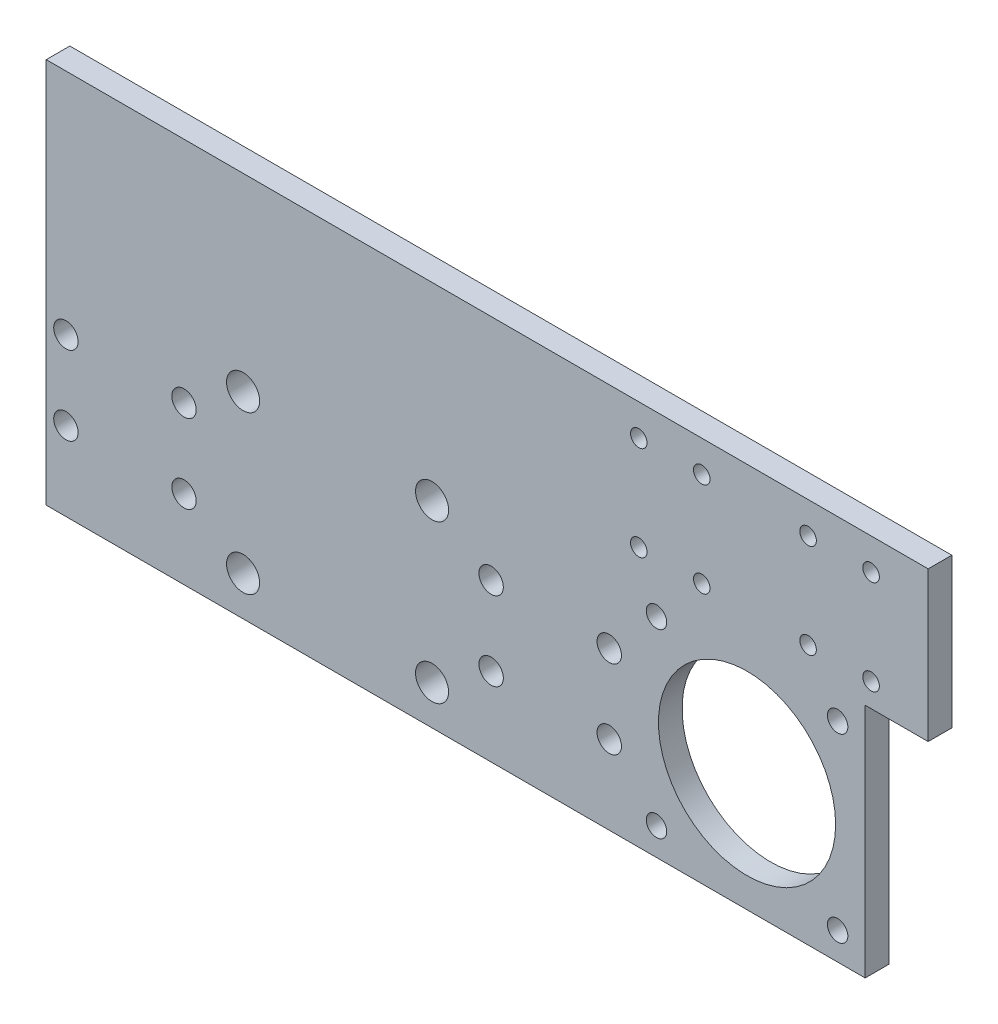
from build123d import *

# Parameters (mm, degrees)
SKETCH_1_W          = 74
SKETCH_1_H          = 30
EXTRUDE_1_DEPTH     = 3
SKETCH_2_R          = 1.55
SKETCH_2_R_2        = 2.1
CUT_EXTRUDE_1_DEPTH = 3
SKETCH_3_W          = 30
SKETCH_3_H          = 30
SKETCH_3_R          = 11.25
SKETCH_3_R_2        = 1.3
EXTRUDE_2_DEPTH     = 3
SKETCH_4_W          = 74
SKETCH_4_H          = 19
EXTRUDE_3_DEPTH     = 3
SKETCH_5_R          = 1.05
CUT_EXTRUDE_2_DEPTH = 10
SKETCH_6_R          = 1.05
CUT_EXTRUDE_4_DEPTH = 10
SKETCH_7_W          = 30
SKETCH_7_H          = 3
EXTRUDE_4_DEPTH     = 19
SKETCH_10_W         = 8
SKETCH_10_H         = 19
EXTRUDE_6_DEPTH     = 3
SKETCH_11_R         = 1.05
CUT_EXTRUDE_5_DEPTH = 10
SKETCH_12_W         = 72.681959433
SKETCH_12_H         = 19
EXTRUDE_7_DEPTH     = 3
SKETCH_13_R         = 1.05
CUT_EXTRUDE_7_DEPTH = 3


with BuildPart() as part:
    # 草图1 → 凸台-拉伸1 (new body)
    with BuildSketch(Plane.XY):
        Rectangle(SKETCH_1_W, SKETCH_1_H)
    extrude(amount=EXTRUDE_1_DEPTH)

    # 草图2 → 切除-拉伸1 (cut)
    with BuildSketch(Plane(origin=(0, 0, 0), x_dir=(-1, 0, 0), z_dir=(0, 0, -1))):
        with Locations((-34.5, 5)):
            Circle(SKETCH_2_R)
        with Locations((-34.5, -5)):
            Circle(SKETCH_2_R)
        with Locations((-19.5, 5)):
            Circle(SKETCH_2_R)
        with Locations((-19.5, -5)):
            Circle(SKETCH_2_R)
        with Locations((-12, 10)):
            Circle(SKETCH_2_R_2)
        with Locations((12, 10)):
            Circle(SKETCH_2_R_2)
        with Locations((-12, -10)):
            Circle(SKETCH_2_R_2)
        with Locations((12, -10)):
            Circle(SKETCH_2_R_2)
        with Locations((34.5, 5)):
            Circle(SKETCH_2_R)
        with Locations((34.5, -5)):
            Circle(SKETCH_2_R)
        with Locations((19.5, 5)):
            Circle(SKETCH_2_R)
        with Locations((19.5, -5)):
            Circle(SKETCH_2_R)
    extrude(amount=-CUT_EXTRUDE_1_DEPTH, mode=Mode.SUBTRACT)

    # 草图3 → 凸台-拉伸2 (add)
    with BuildSketch(Plane.XY.offset(3)):
        with Locations((52, 0)):
            Rectangle(SKETCH_3_W, SKETCH_3_H)
        with Locations((52, 0)):
            Circle(SKETCH_3_R, mode=Mode.SUBTRACT)
        with Locations((40.5, 11.5)):
            Circle(SKETCH_3_R_2, mode=Mode.SUBTRACT)
        with Locations((63.5, 11.5)):
            Circle(SKETCH_3_R_2, mode=Mode.SUBTRACT)
        with Locations((40.5, -11.5)):
            Circle(SKETCH_3_R_2, mode=Mode.SUBTRACT)
        with Locations((63.5, -11.5)):
            Circle(SKETCH_3_R_2, mode=Mode.SUBTRACT)
    extrude(amount=-EXTRUDE_2_DEPTH)

    # 草图4 → 凸台-拉伸3 (add, through all)
    with BuildSketch(Plane.XY.offset(3)):
        with Locations((0, 24.5)):
            Rectangle(SKETCH_4_W, SKETCH_4_H)
    extrude(amount=-EXTRUDE_3_DEPTH)

    # 草图5 → 切除-拉伸2 (cut)
    with BuildSketch(Plane.XY.offset(3)):
        with Locations((-21.5, 31.5)):
            Circle(SKETCH_5_R)
        with Locations((-21.5, 16.5)):
            Circle(SKETCH_5_R)
        with Locations((-11.5, 31.5)):
            Circle(SKETCH_5_R)
        with Locations((-11.5, 16.5)):
            Circle(SKETCH_5_R)
        with Locations((27, 31.5)):
            Circle(SKETCH_5_R)
        with Locations((17, 31.5)):
            Circle(SKETCH_5_R)
        with Locations((17, 16.5)):
            Circle(SKETCH_5_R)
        with Locations((27, 16.5)):
            Circle(SKETCH_5_R)
    extrude(amount=-CUT_EXTRUDE_2_DEPTH, mode=Mode.SUBTRACT)

    # 草图6 → 切除-拉伸4 (cut)
    with BuildSketch(Plane.XY.offset(3)):
        with Locations((-20.5, 30)):
            Circle(SKETCH_6_R)
        with Locations((-12.5, 30)):
            Circle(SKETCH_6_R)
        with Locations((-12.5, 18)):
            Circle(SKETCH_6_R)
        with Locations((-20.5, 18)):
            Circle(SKETCH_6_R)
        with Locations((18, 30)):
            Circle(SKETCH_6_R)
        with Locations((26, 30)):
            Circle(SKETCH_6_R)
        with Locations((26, 18)):
            Circle(SKETCH_6_R)
        with Locations((18, 18)):
            Circle(SKETCH_6_R)
    extrude(amount=-CUT_EXTRUDE_4_DEPTH, mode=Mode.SUBTRACT)

    # 草图7 → 凸台-拉伸4 (add, through all)
    with BuildSketch(Plane(origin=(0, 15, 0), x_dir=(1, 0, 0), z_dir=(0, 1, 0))):
        with Locations((52, -1.5)):
            Rectangle(SKETCH_7_W, SKETCH_7_H)
    extrude(amount=EXTRUDE_4_DEPTH)

    # 草图10 → 凸台-拉伸6 (add)
    with BuildSketch(Plane(origin=(0, 0, 0), x_dir=(-1, 0, 0), z_dir=(0, 0, -1))):
        with Locations((-71, 24.5)):
            Rectangle(SKETCH_10_W, SKETCH_10_H)
    extrude(amount=-EXTRUDE_6_DEPTH)

    # 草图11 → 切除-拉伸5 (cut)
    with BuildSketch(Plane.XY.offset(3)):
        with Locations((59.75, 30)):
            Circle(SKETCH_11_R)
        with Locations((67.75, 30)):
            Circle(SKETCH_11_R)
        with Locations((59.75, 18)):
            Circle(SKETCH_11_R)
        with Locations((67.75, 18)):
            Circle(SKETCH_11_R)
    extrude(amount=-CUT_EXTRUDE_5_DEPTH, mode=Mode.SUBTRACT)

    # 草图12 → 凸台-拉伸7 (add)
    with BuildSketch(Plane.XY):
        with Locations((-0.659020283, 24.5)):
            Rectangle(SKETCH_12_W, SKETCH_12_H)
    extrude(amount=EXTRUDE_7_DEPTH)

    # 草图13 → 切除-拉伸7 (cut)
    with BuildSketch(Plane.XY):
        with Locations((46.25, 30)):
            Circle(SKETCH_13_R)
        with Locations((46.25, 18)):
            Circle(SKETCH_13_R)
        with Locations((38.25, 18)):
            Circle(SKETCH_13_R)
        with Locations((38.25, 30)):
            Circle(SKETCH_13_R)
    extrude(amount=CUT_EXTRUDE_7_DEPTH, mode=Mode.SUBTRACT)


solid = part.part
